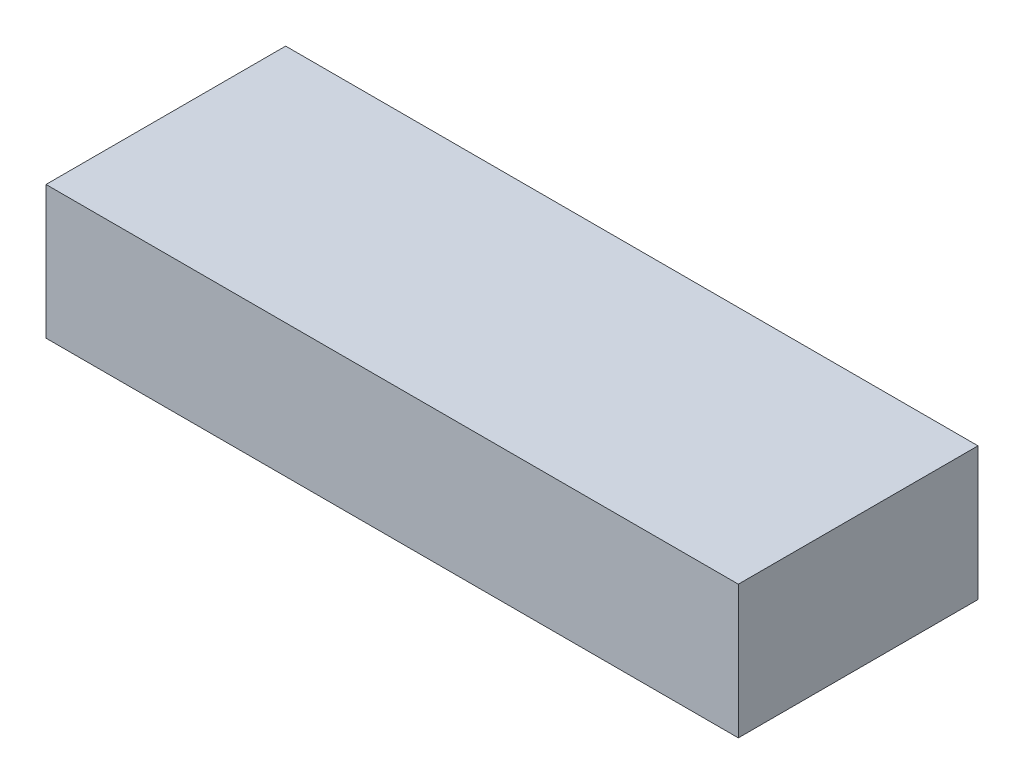
from build123d import *

# Parameters (mm, degrees)
SKETCH_1_W      = 130
SKETCH_1_H      = 45
EXTRUDE_1_DEPTH = 25


with BuildPart() as part:
    # Эскиз1 → Бобышка-Вытянуть1 (new body)
    with BuildSketch(Plane(origin=(0, 0, 0), x_dir=(1, 0, 0), z_dir=(0, 1, 0))):
        Rectangle(SKETCH_1_W, SKETCH_1_H)
    extrude(amount=EXTRUDE_1_DEPTH)


solid = part.part
